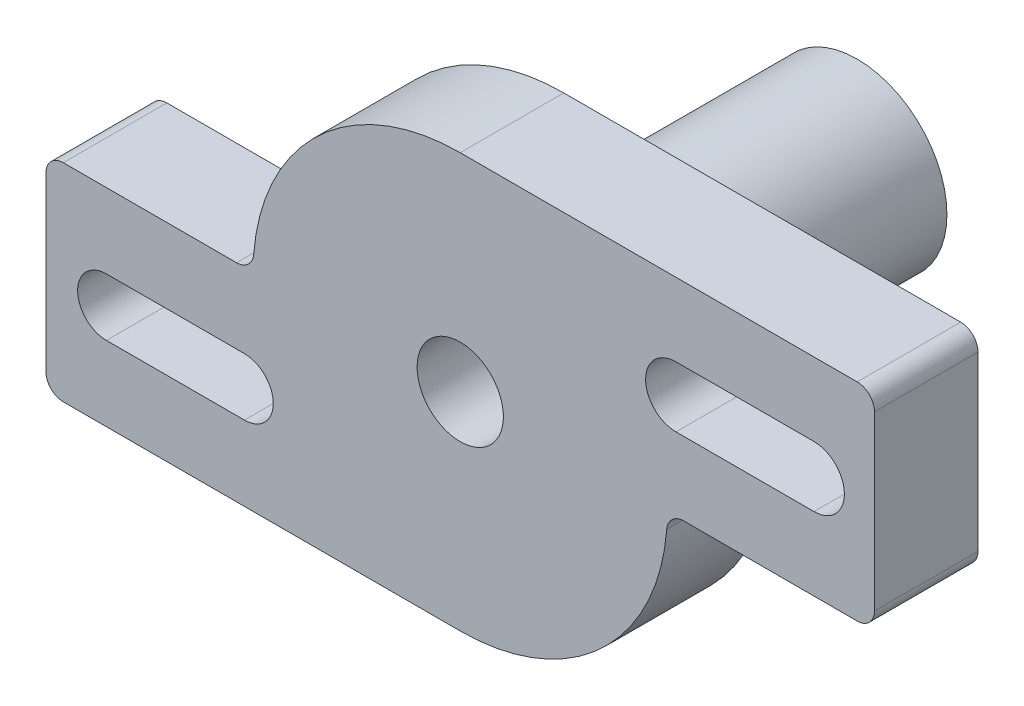
from build123d import *

# Parameters (mm, degrees)
BOSS_EXTRUDE1_DEPTH = 3
SKETCH2_R           = 2.6
BOSS_EXTRUDE2_DEPTH = 8.5
M3_TAPPED_HOLE1_D   = 2.5
FILLET1_R           = 0.5


with BuildPart() as part:
    # Sketch1 → Boss-Extrude1 (new body)
    with BuildSketch(Plane.XY):
        with BuildLine():
            Line((-47.789798407, 94.395653496), (-35.789798407, 94.395653496))
            Line((-35.789798407, 94.395653496), (-35.789798407, 88.395653496))
            Line((-35.789798407, 88.395653496), (-41.789798407, 88.395653496))
            ThreePointArc((-41.789798407, 88.395653496), (-43.54715772, 84.153012809), (-47.789798407, 82.395653496))
            Line((-47.789798407, 82.395653496), (-59.789798407, 82.395653496))
            Line((-59.789798407, 82.395653496), (-59.789798407, 88.395653496))
            Line((-59.789798407, 88.395653496), (-53.789798407, 88.395653496))
            ThreePointArc((-53.789798407, 88.395653496), (-52.032439094, 92.638294183), (-47.789798407, 94.395653496))
        make_face()
        with BuildLine():
            Line((-37.539798407, 90.516657199), (-41.539798407, 90.516657199))
            ThreePointArc((-41.539798407, 90.516657199), (-42.418794704, 91.395653496), (-41.539798407, 92.274649793))
            Line((-41.539798407, 92.274649793), (-37.539798407, 92.274649793))
            ThreePointArc((-37.539798407, 92.274649793), (-36.66080211, 91.395653496), (-37.539798407, 90.516657199))
        make_face(mode=Mode.SUBTRACT)
        with BuildLine():
            Line((-58.039798407, 86.229692735), (-54.039798407, 86.229692735))
            ThreePointArc((-54.039798407, 86.229692735), (-53.205759169, 85.395653496), (-54.039798407, 84.561614258))
            Line((-54.039798407, 84.561614258), (-58.039798407, 84.561614258))
            ThreePointArc((-58.039798407, 84.561614258), (-58.873837646, 85.395653496), (-58.039798407, 86.229692735))
        make_face(mode=Mode.SUBTRACT)
    extrude(amount=BOSS_EXTRUDE1_DEPTH)

    # Sketch2 → Boss-Extrude2 (add)
    with BuildSketch(Plane(origin=(0, 0, 0), x_dir=(-1, 0, 0), z_dir=(0, 0, -1))):
        with Locations(Location((47.789798407, 88.395653496, 0), (0, 0, 180))):
            Circle(SKETCH2_R)
    extrude(amount=BOSS_EXTRUDE2_DEPTH)

    # M3 Tapped Hole1 (through all)
    with Locations(Plane(origin=(0, 0, -8.5), x_dir=(-1, 0, 0), z_dir=(0, 0, -1))):
        with Locations((47.789798407, 88.395653496)):
            Hole(M3_TAPPED_HOLE1_D / 2)

    # Fillet1
    fillet1_edges = [part.edges().sort_by_distance(p)[0] for p in [
        (-35.789798407, 94.395653496, 1.5),
        (-35.789798407, 88.395653496, 1.5),
        (-41.789798407, 88.395653496, 1.5),
        (-59.789798407, 82.395653496, 1.5),
        (-59.789798407, 88.395653496, 1.5),
        (-53.789798407, 88.395653496, 1.5),
        (-50.389798407, 88.395653496, 0),
    ]]
    fillet(fillet1_edges, radius=FILLET1_R)


solid = part.part
